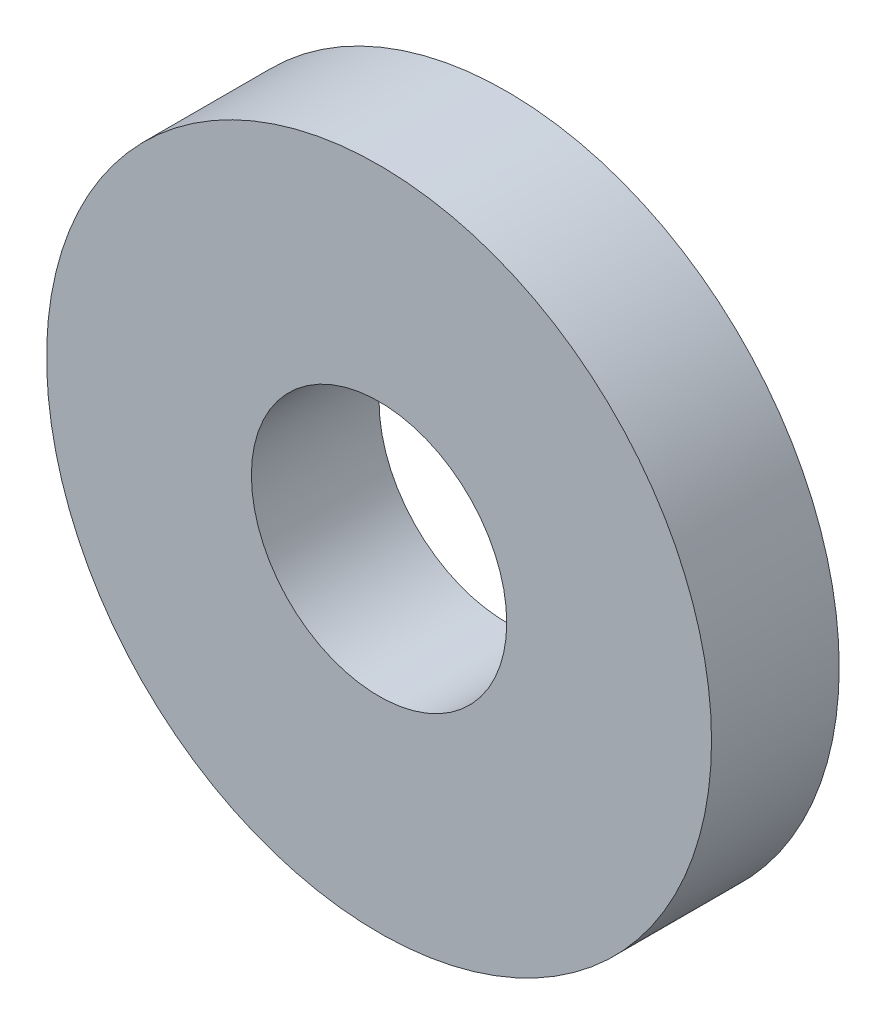
from build123d import *

# Parameters (mm, degrees)
SKETCH1_R           = 4.133736316
SKETCH1_R_2         = 1.5875
BOSS_EXTRUDE1_DEPTH = 1.5875


with BuildPart() as part:
    # Sketch1 → Boss-Extrude1 (new body)
    with BuildSketch(Plane.XY):
        with Locations((-21, 0)):
            Circle(SKETCH1_R)
        with Locations((-21, 0)):
            Circle(SKETCH1_R_2, mode=Mode.SUBTRACT)
    extrude(amount=BOSS_EXTRUDE1_DEPTH)


solid = part.part
